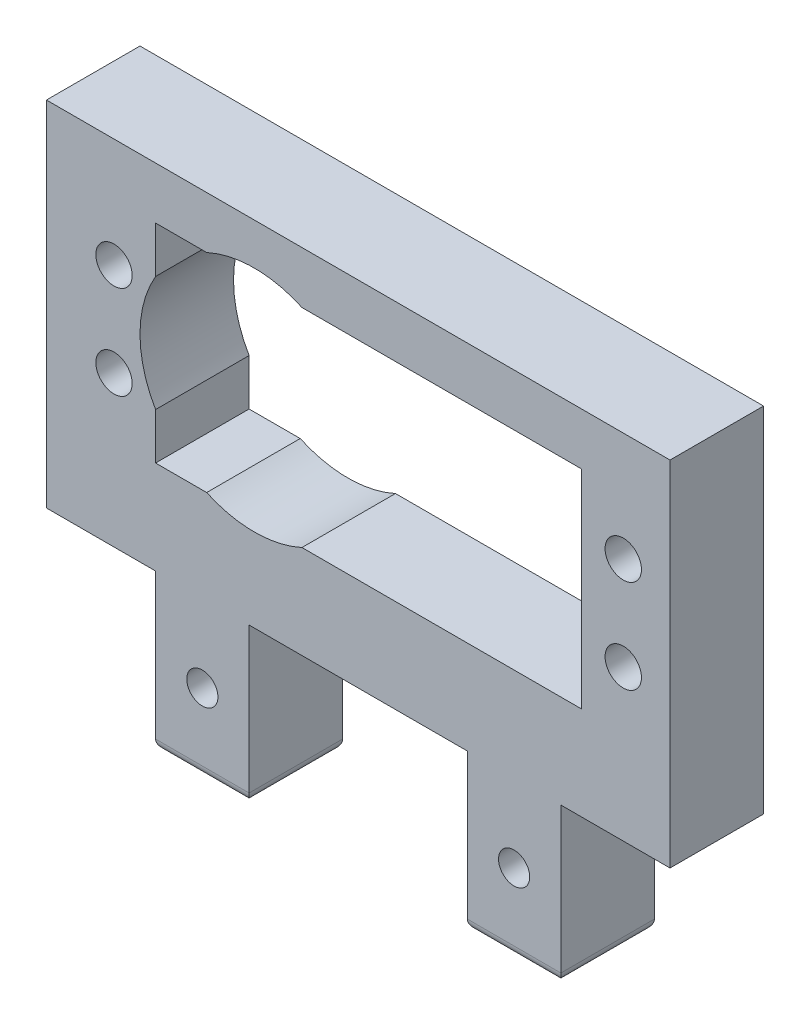
from build123d import *

# Parameters (mm, degrees)
CROQUIS1_R              = 1.75
CROQUIS1_R_2            = 1.5
SALIENTE_EXTRUIR1_DEPTH = 9
REDONDEO1_R             = 1


with BuildPart() as part:
    # Croquis1 → Saliente-Extruir1 (new body)
    with BuildSketch(Plane.XY):
        Polygon((0, 34), (0, 0), (10.5, 0), (10.5, -15), (19.5, -15), (19.5, 0), (40.5, 0), (40.5, -15), (49.5, -15), (49.5, 0), (60, 0), (60, 34), align=None)
        with Locations((6.5, 14.5)):
            Circle(CROQUIS1_R, mode=Mode.SUBTRACT)
        with Locations((6.5, 23.5)):
            Circle(CROQUIS1_R, mode=Mode.SUBTRACT)
        with BuildLine():
            Line((10.5, 24.545268253), (10.5, 29))
            Line((10.5, 29), (15.417424305, 29))
            ThreePointArc((15.417424305, 29), (20, 30), (24.582575695, 29))
            Line((24.582575695, 29), (51.5, 29))
            Line((51.5, 29), (51.5, 9))
            Line((51.5, 9), (24.582575695, 9))
            ThreePointArc((24.582575695, 9), (20, 8), (15.417424305, 9))
            Line((15.417424305, 9), (10.5, 9))
            Line((10.5, 9), (10.5, 13.454731747))
            ThreePointArc((10.5, 13.454731747), (9, 19), (10.5, 24.545268253))
        make_face(mode=Mode.SUBTRACT)
        with Locations((55.5, 14.5)):
            Circle(CROQUIS1_R, mode=Mode.SUBTRACT)
        with Locations((55.5, 23.5)):
            Circle(CROQUIS1_R, mode=Mode.SUBTRACT)
        with Locations((15, -7.5)):
            Circle(CROQUIS1_R_2, mode=Mode.SUBTRACT)
        with Locations((45, -7.5)):
            Circle(CROQUIS1_R_2, mode=Mode.SUBTRACT)
    extrude(amount=SALIENTE_EXTRUIR1_DEPTH)

    # Redondeo1
    redondeo1_edges = [part.edges().sort_by_distance(p)[0] for p in [
        (45, -15, 0),
        (15, -15, 0),
        (49.5, -15, 4.5),
        (40.5, -15, 4.5),
        (19.5, -15, 4.5),
        (10.5, -15, 4.5),
        (15, -15, 9),
        (45, -15, 9),
    ]]
    fillet(redondeo1_edges, radius=REDONDEO1_R)


solid = part.part
